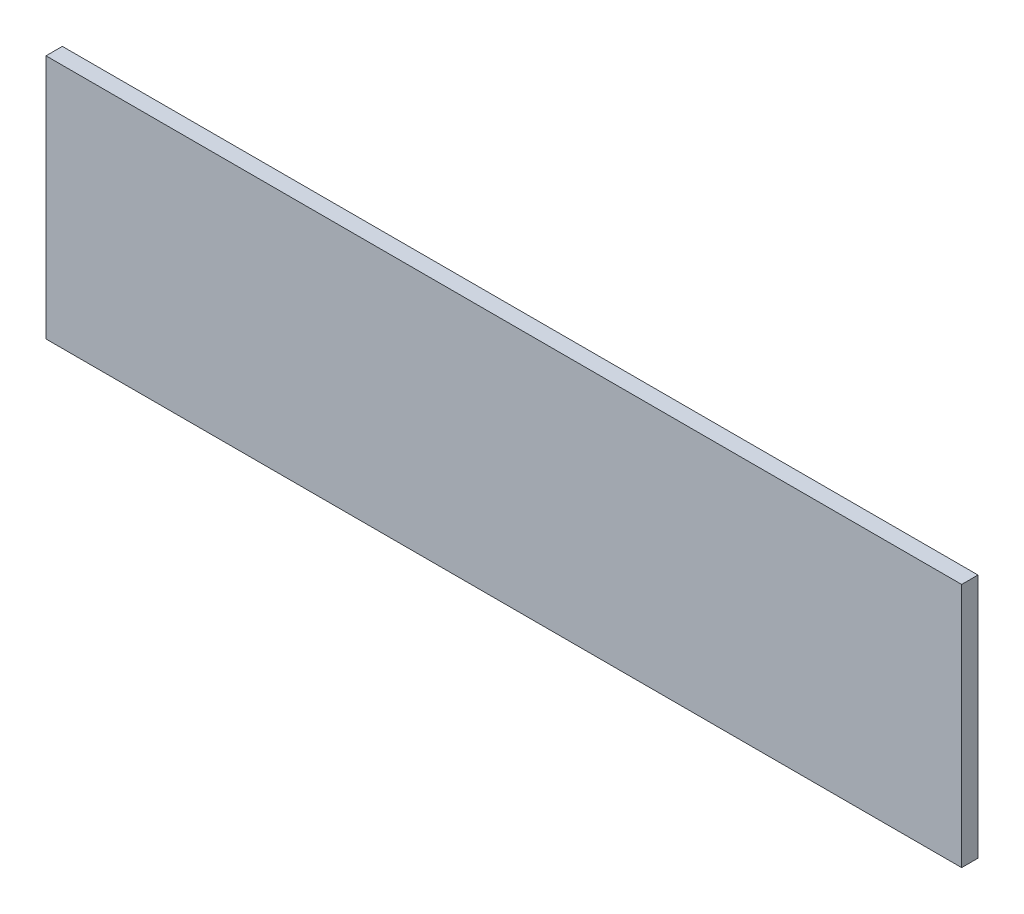
from build123d import *

# Parameters (mm, degrees)
ESBO_O1_W                = 56
ESBO_O1_H                = 15
RESSALTO_EXTRUS_O1_DEPTH = 1


with BuildPart() as part:
    # Esboço1 → Ressalto-extrusão1 (new body)
    with BuildSketch(Plane.XY):
        with Locations((30.591212709, 31.192455426)):
            Rectangle(ESBO_O1_W, ESBO_O1_H)
    extrude(amount=RESSALTO_EXTRUS_O1_DEPTH)


solid = part.part
